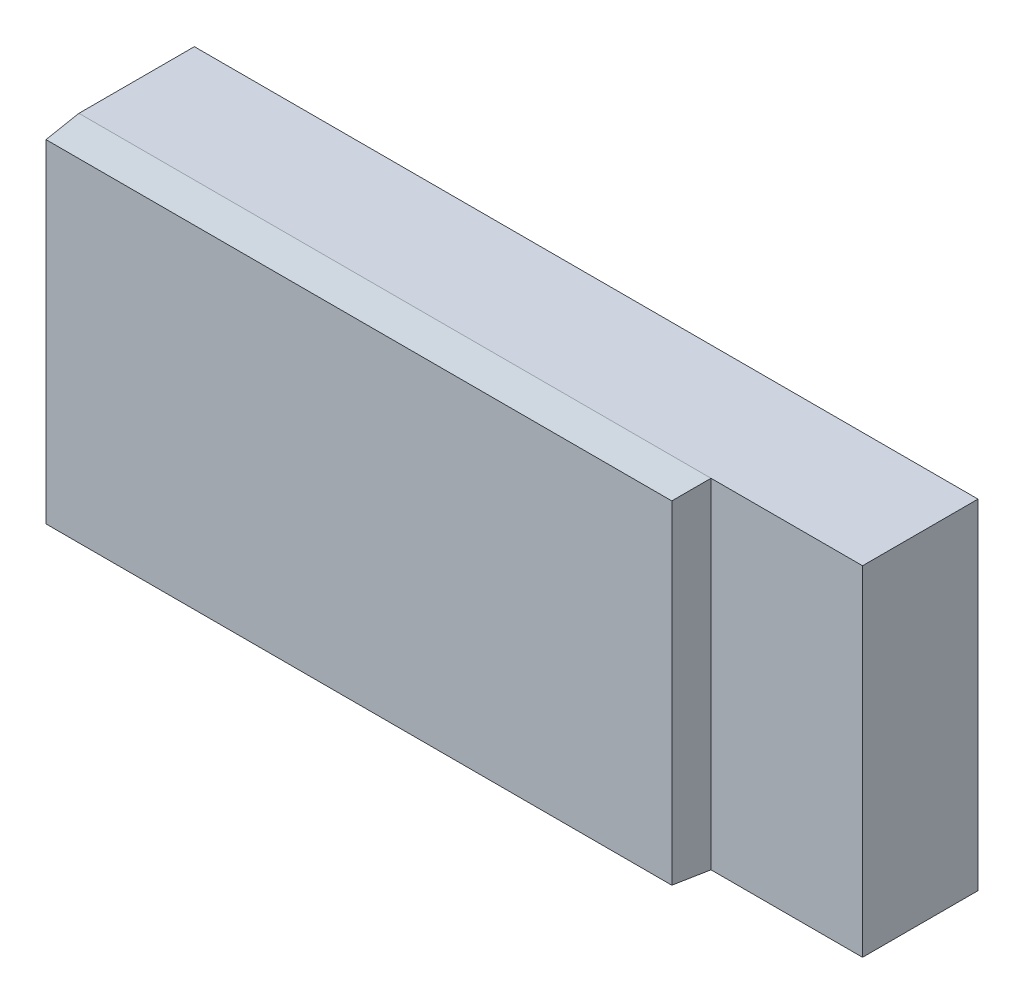
from build123d import *

# Parameters (mm, degrees)
SKETCH1_W           = 27.15
SKETCH1_H           = 11.75
BOSS_EXTRUDE1_DEPTH = 4
SKETCH2_W           = 21.9
SKETCH2_H           = 11.75
BOSS_EXTRUDE2_DEPTH = 1.25
BOSS_EXTRUDE2_TAPER = 5


with BuildPart() as part:
    # Sketch1 → Boss-Extrude1 (new body)
    with BuildSketch(Plane.XY):
        Rectangle(SKETCH1_W, SKETCH1_H)
    extrude(amount=BOSS_EXTRUDE1_DEPTH)

    # Sketch2 → Boss-Extrude2 (add)
    with BuildSketch(Plane.XY.offset(4)):
        with Locations((-2.625, 0)):
            Rectangle(SKETCH2_W, SKETCH2_H)
    extrude(amount=BOSS_EXTRUDE2_DEPTH, taper=BOSS_EXTRUDE2_TAPER)


solid = part.part
